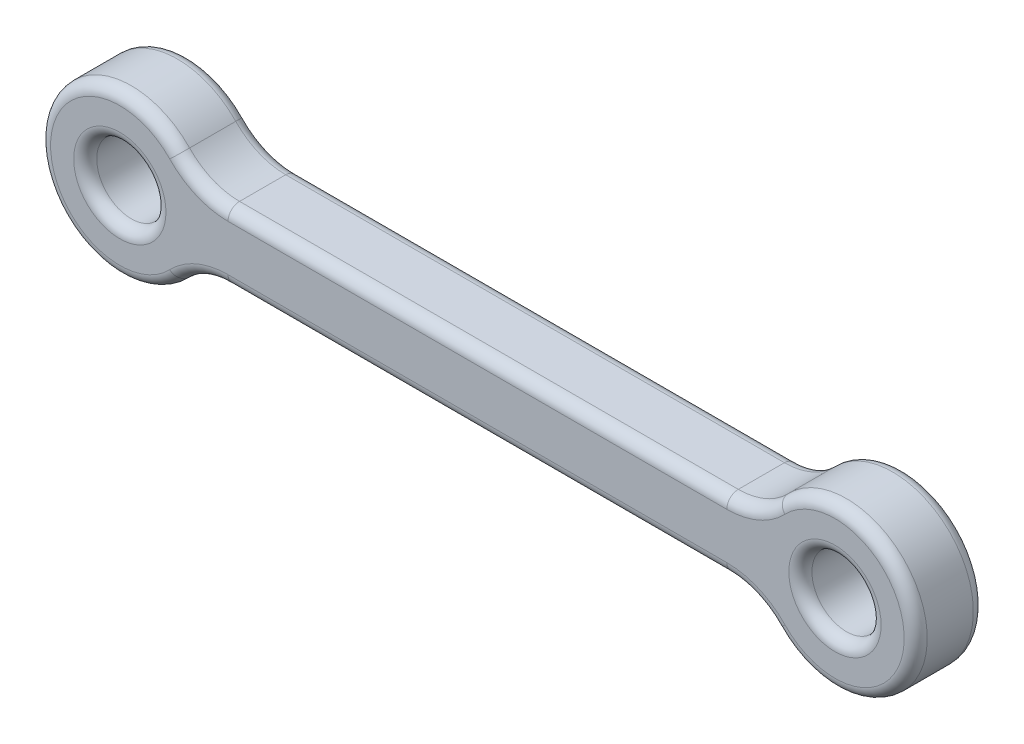
from build123d import *

# Parameters (mm, degrees)
SKETCH1_R           = 1.5
BOSS_EXTRUDE1_DEPTH = 3
FILLET1_R           = 0.5
SCALE1_SCALE        = 1.9


with BuildPart() as part:
    # Sketch1 → Boss-Extrude1 (new body)
    with BuildSketch(Plane.XY):
        with BuildLine():
            Line((4.69041576, 1.5), (26.30958424, 1.5))
            ThreePointArc((26.30958424, 1.5), (27.486281051, 1.740401367), (28.474391514, 2.423076923))
            ThreePointArc((28.474391514, 2.423076923), (34.5, 0), (28.474391514, -2.423076923))
            ThreePointArc((28.474391514, -2.423076923), (27.486281051, -1.740401367), (26.30958424, -1.5))
            Line((26.30958424, -1.5), (4.69041576, -1.5))
            ThreePointArc((4.69041576, -1.5), (3.513718949, -1.740401367), (2.525608486, -2.423076923))
            ThreePointArc((2.525608486, -2.423076923), (-3.5, 0), (2.525608486, 2.423076923))
            ThreePointArc((2.525608486, 2.423076923), (3.513718949, 1.740401367), (4.69041576, 1.5))
        make_face()
        Circle(SKETCH1_R, mode=Mode.SUBTRACT)
        with Locations((31, 0)):
            Circle(SKETCH1_R, mode=Mode.SUBTRACT)
    extrude(amount=-BOSS_EXTRUDE1_DEPTH)

    # Fillet1
    fillet1_edges = [part.edges().sort_by_distance(p)[0] for p in [
        (-3.5, 0, 0),
        (3.513718949, 1.740401367, 0),
        (15.5, 1.5, 0),
        (27.486281051, 1.740401367, 0),
        (3.513718949, 1.740401367, -3),
        (-3.5, 0, -3),
        (3.513718949, -1.740401367, -3),
        (-1.5, 0, 0),
        (15.5, -1.5, -3),
        (29.5, 0, -3),
        (29.5, 0, 0),
        (27.486281051, -1.740401367, -3),
        (34.5, 0, -3),
        (27.486281051, 1.740401367, -3),
        (34.5, 0, 0),
        (15.5, 1.5, -3),
        (27.486281051, -1.740401367, 0),
        (15.5, -1.5, 0),
        (3.513718949, -1.740401367, 0),
    ]]
    fillet(fillet1_edges, radius=FILLET1_R)


with BuildPart() as part_1:
    # Scale1: scaled about (15.478903788, 0, -1.501893929)
    add(part.part.scale(SCALE1_SCALE).moved(Location((-13.931013409, 0, 1.351704536))))


solid = part_1.part
